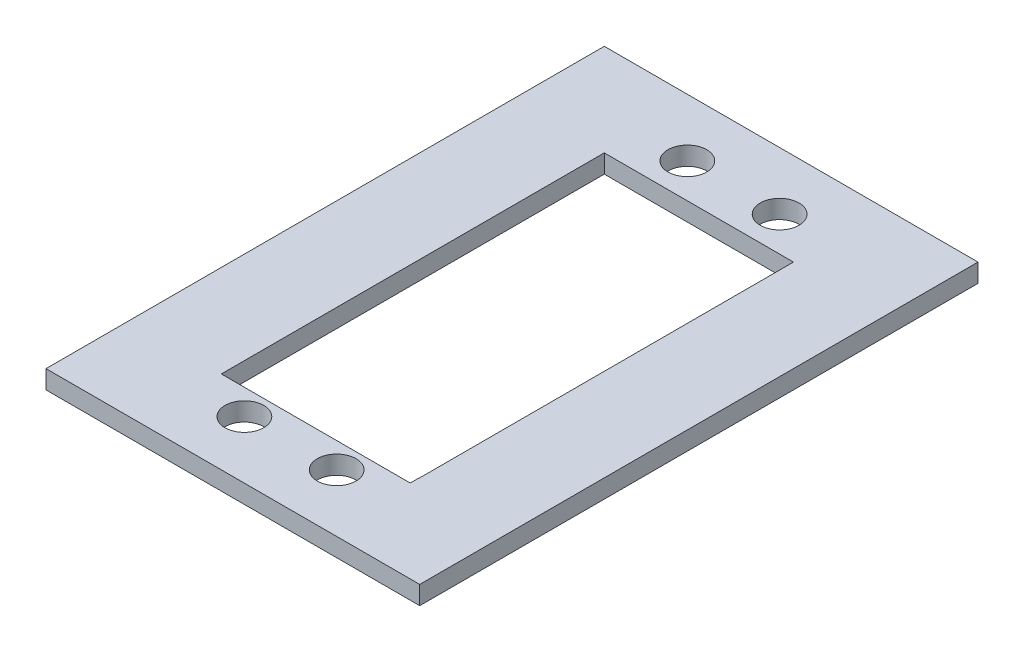
from build123d import *

# Parameters (mm, degrees)
SKETCH_1_W          = 40.5
SKETCH_1_H          = 60.5
SKETCH_1_R          = 2.1
EXTRUDE_2_DEPTH     = 2
SKETCH_3_W          = 20.471244586
SKETCH_3_H          = 1
CUT_EXTRUDE_2_DEPTH = 2


with BuildPart() as part:
    # 草图1 → 凸台-拉伸2 (new body)
    # profile 1 of 2: a face of its own
    with BuildSketch(Plane(origin=(0, 0, 0), x_dir=(1, 0, 0), z_dir=(0, 1, 0))):
        Rectangle(SKETCH_1_W, SKETCH_1_H)
        with Locations(Location((-5, -24, 0), (0, 0, 270))):
            Circle(SKETCH_1_R, mode=Mode.SUBTRACT)
        with Locations(Location((5, -24, 0), (0, 0, 270))):
            Circle(SKETCH_1_R, mode=Mode.SUBTRACT)
        with BuildLine():
            Line((10.25, -20.25), (-10.25, -20.25))
            Line((-10.25, -20.25), (-10.25, 20.25))
            Line((-10.25, 20.25), (-5, 20.25))
            Line((-5, 20.25), (-5, 21.9))
            ThreePointArc((-5, 21.9), (-6.48492424, 25.48492424), (-2.9, 24))
            Line((-2.9, 24), (2.9, 24))
            ThreePointArc((2.9, 24), (5, 26.1), (7.1, 24))
            ThreePointArc((7.1, 24), (6.48492424, 22.51507576), (5, 21.9))
            Line((5, 21.9), (5, 20.25))
            Line((5, 20.25), (10.25, 20.25))
            Line((10.25, 20.25), (10.25, -20.25))
        make_face(mode=Mode.SUBTRACT)
    # profile 2 of 2: a face of its own
    with BuildSketch(Plane(origin=(0, 0, 0), x_dir=(1, 0, 0), z_dir=(0, 1, 0))):
        with BuildLine():
            Line((-5, 21.9), (-5, 20.25))
            Line((-5, 20.25), (5, 20.25))
            Line((5, 20.25), (5, 21.9))
            ThreePointArc((5, 21.9), (3.51507576, 22.51507576), (2.9, 24))
            Line((2.9, 24), (-2.9, 24))
            ThreePointArc((-2.9, 24), (-3.51507576, 22.51507576), (-5, 21.9))
        make_face()
    extrude(amount=EXTRUDE_2_DEPTH)

    # 草图3 → 切除-拉伸2 (cut)
    with BuildSketch(Plane(origin=(0, 2, 0), x_dir=(1, 0, 0), z_dir=(0, 1, 0))):
        with Locations((-0.014377707, -20.75)):
            Rectangle(SKETCH_3_W, SKETCH_3_H)
    extrude(amount=-CUT_EXTRUDE_2_DEPTH, mode=Mode.SUBTRACT)


solid = part.part
